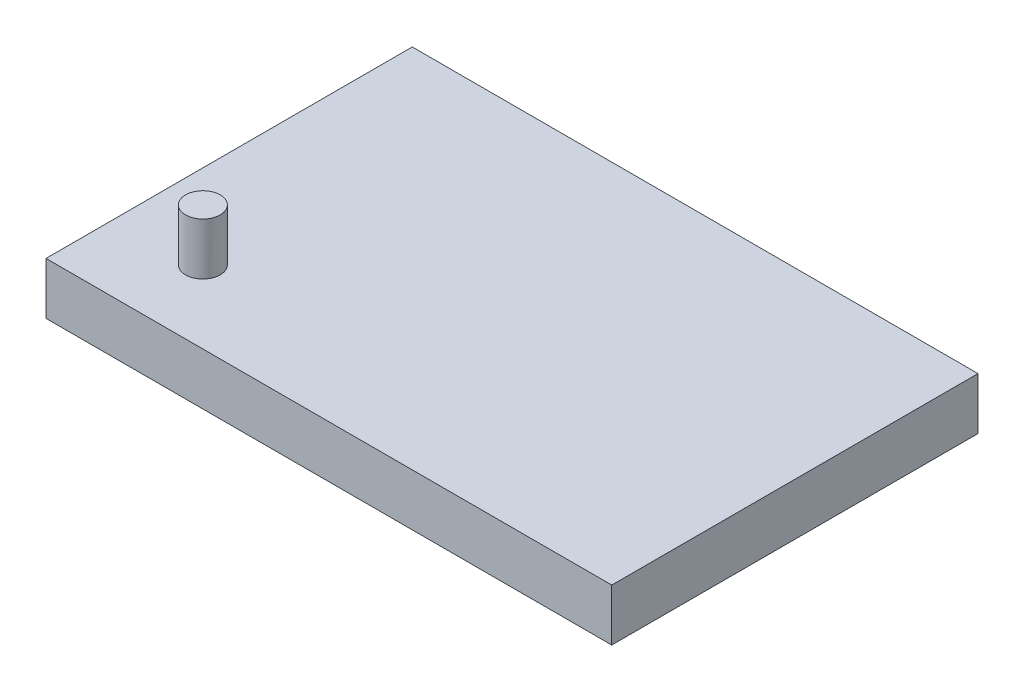
from build123d import *

# Parameters (mm, degrees)
SKETCH4_W           = 163.250183294
SKETCH4_H           = 105.686219408
BOSS_EXTRUDE2_DEPTH = 15
SKETCH5_R           = 5
BOSS_EXTRUDE3_DEPTH = 15


with BuildPart() as part:
    # Sketch4 → Boss-Extrude2 (new body)
    with BuildSketch(Plane(origin=(0, 0, 0), x_dir=(1, 0, 0), z_dir=(0, 1, 0))):
        Rectangle(SKETCH4_W, SKETCH4_H)
    extrude(amount=BOSS_EXTRUDE2_DEPTH)

    # Sketch5 → Boss-Extrude3 (add)
    with BuildSketch(Plane(origin=(0, 15, 0), x_dir=(1, 0, 0), z_dir=(0, 1, 0))):
        with Locations(Location((-57.368656938, -31.833015038, 0), (0, 0, 90))):
            Circle(SKETCH5_R)
    extrude(amount=BOSS_EXTRUDE3_DEPTH)


solid = part.part
